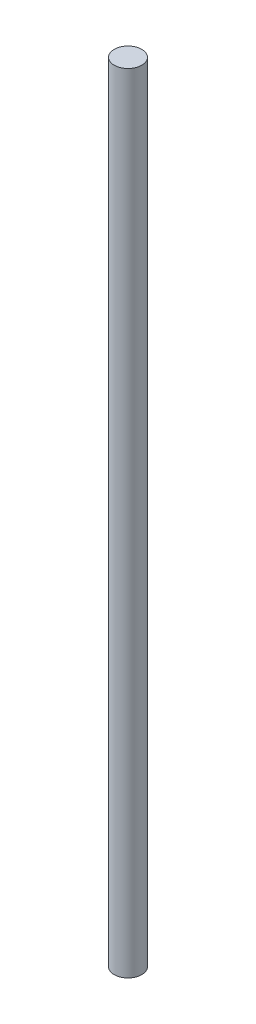
from build123d import *

# Parameters (mm, degrees)
SKETCH1_R           = 0.7
BOSS_EXTRUDE1_DEPTH = 40


with BuildPart() as part:
    # Sketch1 → Boss-Extrude1 (new body)
    with BuildSketch(Plane(origin=(0, 0, 0), x_dir=(1, 0, 0), z_dir=(0, 1, 0))):
        with Locations(Location((0, 0, 0), (0, 0, 270))):
            Circle(SKETCH1_R)
    extrude(amount=BOSS_EXTRUDE1_DEPTH)


solid = part.part
